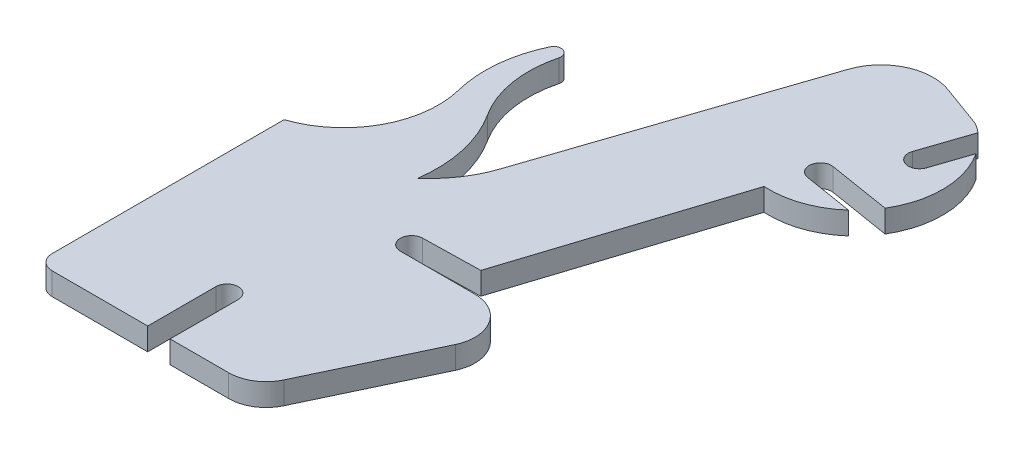
from build123d import *

# Parameters (mm, degrees)
BOSS_EXTRUDE1_DEPTH = 1.5
FILLET1_R           = 5
FILLET3_R           = 7
FILLET4_R           = 2
FILLET5_R           = 5


with BuildPart() as part:
    # Sketch1 → Boss-Extrude1 (new, symmetric)
    with BuildSketch(Plane(origin=(0, 0, 0), x_dir=(1, 0, 0), z_dir=(0, 1, 0))):
        with BuildLine():
            Line((0, 33.06), (0, 0))
            Line((0, 0), (14.8, 0))
            Line((14.8, 0), (14.8, 9.13))
            ThreePointArc((14.8, 9.13), (16.3, 10.63), (17.8, 9.13))
            Line((17.8, 9.13), (17.8, 0))
            Line((17.8, 0), (28.82, 0))
            Line((28.82, 0), (40.93, 25.6))
            Line((40.93, 25.6), (23.039915269, 25.6))
            ThreePointArc((23.039915269, 25.6), (21.54, 27.084056775), (23.00803062, 28.599661085))
            Line((23.00803062, 28.599661085), (30.66, 28.762351413))
            Line((30.66, 28.762351413), (39.893121089, 57.462102219))
            ThreePointArc((39.893121089, 57.462102219), (44.38174059, 58.083541414), (48.292108688, 60.373282238))
            Line((48.292108688, 60.373282238), (41.74, 61.438906704))
            ThreePointArc((41.74, 61.438906704), (40.500247088, 63.160247088), (42.221587473, 64.4))
            Line((42.221587473, 64.4), (50.522210261, 63.05))
            ThreePointArc((50.522210261, 63.05), (52.200549071, 69.291091406), (50.287964746, 75.464426347))
            Line((50.287964746, 75.464426347), (48.619556224, 70.509026223))
            ThreePointArc((48.619556224, 70.509026223), (46.719339491, 69.566064737), (45.776378004, 71.466281471))
            Line((45.776378004, 71.466281471), (47.986855886, 78.031701286))
            ThreePointArc((47.986855886, 78.031701286), (47.402242068, 78.484891921), (46.79, 78.9))
            Line((46.79, 78.9), (34.22, 83.484702826))
            Line((34.22, 83.484702826), (20.171354305, 41.75831525))
            ThreePointArc((20.171354305, 41.75831525), (18.405987937, 38.194020326), (15.753217128, 35.230319303))
            ThreePointArc((15.753217128, 35.230319303), (15.499590166, 41.461362705), (13.089045589, 47.212841067))
            ThreePointArc((13.089045589, 47.212841067), (10.959051171, 52.738918493), (11.232947268, 58.654946626))
            ThreePointArc((11.232947268, 58.654946626), (10.606012481, 59.845600176), (9.361365657, 59.334173363))
            ThreePointArc((9.361365657, 59.334173363), (7.842242616, 53.86210101), (8.259081404, 48.198395856))
            ThreePointArc((8.259081404, 48.198395856), (7.08728895, 39.015533985), (0, 33.06))
        make_face()
    extrude(amount=BOSS_EXTRUDE1_DEPTH, both=True)

    # Fillet1
    fillet1_edges = [part.edges().sort_by_distance(p)[0] for p in [
        (40.93, 0, -25.6),
    ]]
    fillet(fillet1_edges, radius=FILLET1_R)

    # Fillet3
    fillet3_edges = [part.edges().sort_by_distance(p)[0] for p in [
        (34.22, 0, -83.484702826),
    ]]
    fillet(fillet3_edges, radius=FILLET3_R)

    # Fillet4
    fillet4_edges = [part.edges().sort_by_distance(p)[0] for p in [
        (0, 0, 0),
    ]]
    fillet(fillet4_edges, radius=FILLET4_R)

    # Fillet5
    fillet5_edges = [part.edges().sort_by_distance(p)[0] for p in [
        (28.82, 0, 0),
    ]]
    fillet(fillet5_edges, radius=FILLET5_R)


solid = part.part
